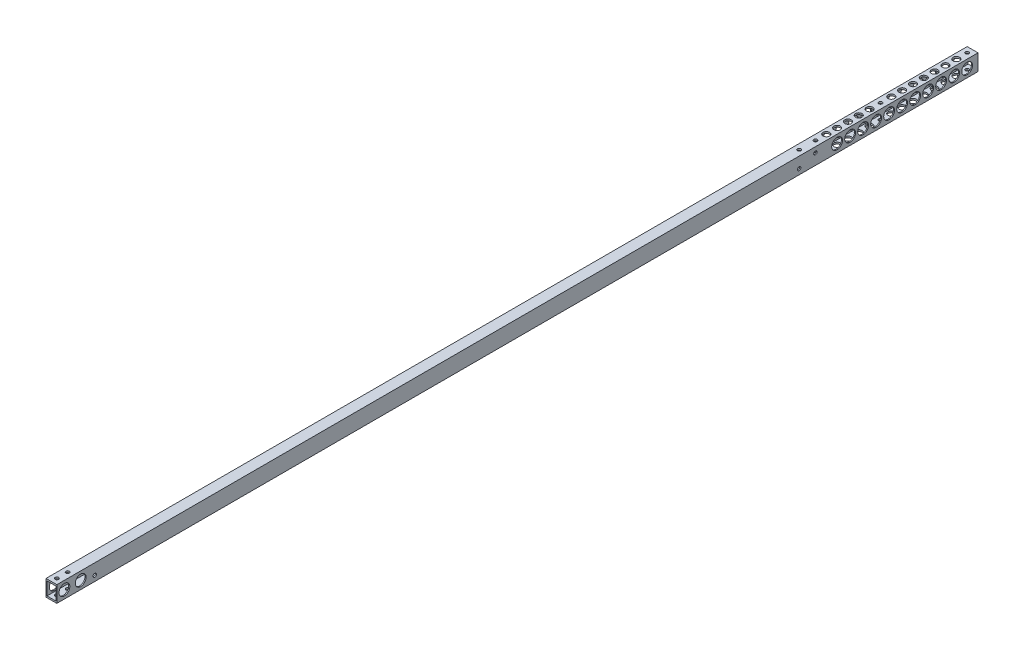
from build123d import *

# Parameters (mm, degrees)
SKETCH_1_W             = 10
SKETCH_1_H             = 15
SKETCH_1_W_2           = 8
SKETCH_1_H_2           = 12
EXTRUDE_1_DEPTH        = 850
SKETCH_2_R             = 1.6
CUT_EXTRUDE_1_DEPTH    = 851.091906796
SKETCH_3_R             = 5
CUT_EXTRUDE_2_DEPTH    = 851.091906796
SKETCH_4_R             = 1.6
CUT_EXTRUDE_3_DEPTH    = 851.147046104
SKETCH_7_R             = 1.6
CUT_EXTRUDE_6_DEPTH    = 851.147046104
SKETCH_8_R             = 5
CUT_EXTRUDE_7_DEPTH    = 851.091906796
PATTERN_LINEAR_1_COUNT = 11
PATTERN_LINEAR_1_PITCH = 12
SKETCH_9_R             = 1.6
CUT_EXTRUDE_8_DEPTH    = 851.147046104
PATTERN_LINEAR_2_COUNT = 2
PATTERN_LINEAR_2_PITCH = 15
SKETCH_10_R            = 3
CUT_EXTRUDE_9_DEPTH    = 851.147046104
PATTERN_LINEAR_3_COUNT = 7
PATTERN_LINEAR_3_PITCH = 10
SKETCH_11_R            = 3
CUT_EXTRUDE_10_DEPTH   = 851.147046104
PATTERN_LINEAR_4_COUNT = 5
PATTERN_LINEAR_4_PITCH = 10


with BuildPart() as part:
    # ｽｹｯﾁ1 → ﾎﾞｽ - 押し出し1 (new body)
    with BuildSketch(Plane.XY):
        Rectangle(SKETCH_1_W, SKETCH_1_H)
        Rectangle(SKETCH_1_W_2, SKETCH_1_H_2, mode=Mode.SUBTRACT)
    extrude(amount=EXTRUDE_1_DEPTH)

    # ｽｹｯﾁ2 → ｶｯﾄ - 押し出し1 (cut, through all)
    with BuildSketch(Plane.ZY.offset(5)):
        with Locations((165, -2.5)):
            Circle(SKETCH_2_R)
        with Locations((815, -2.5)):
            Circle(SKETCH_2_R)
        with Locations((150, 2.5)):
            Circle(SKETCH_2_R)
    extrude(amount=-CUT_EXTRUDE_1_DEPTH, mode=Mode.SUBTRACT)

    # ｽｹｯﾁ3 → ｶｯﾄ - 押し出し2 (cut, through all)
    with BuildSketch(Plane(origin=(5, 0, 0), x_dir=(0, 0, -1), z_dir=(1, 0, 0))):
        with Locations((-843, 0)):
            Circle(SKETCH_3_R)
    cut_extrude_2 = extrude(amount=-CUT_EXTRUDE_2_DEPTH, mode=Mode.SUBTRACT)

    # ｽｹｯﾁ4 → ｶｯﾄ - 押し出し3 (cut, through all)
    with BuildSketch(Plane(origin=(0, 7.5, 0), x_dir=(1, 0, 0), z_dir=(0, 1, 0))):
        with Locations(Location((0, -845, 0), (0, 0, 270))):
            Circle(SKETCH_4_R)
        with Locations(Location((0, -835, 0), (0, 0, 270))):
            Circle(SKETCH_4_R)
    extrude(amount=-CUT_EXTRUDE_3_DEPTH, mode=Mode.SUBTRACT)

    # ｽｹｯﾁ7 → ｶｯﾄ - 押し出し6 (cut, through all)
    with BuildSketch(Plane(origin=(0, -7.5, 0), x_dir=(-1, 0, 0), z_dir=(0, -1, 0))):
        with Locations(Location((0, -5, 0), (0, 0, 90))):
            Circle(SKETCH_7_R)
        with Locations(Location((0, -85, 0), (0, 0, 90))):
            Circle(SKETCH_7_R)
        with Locations(Location((0, -145, 0), (0, 0, 90))):
            Circle(SKETCH_7_R)
    extrude(amount=-CUT_EXTRUDE_6_DEPTH, mode=Mode.SUBTRACT)

    # ｽｹｯﾁ8 → ｶｯﾄ - 押し出し7 (cut, through all)
    with BuildSketch(Plane(origin=(5, 0, 0), x_dir=(0, 0, -1), z_dir=(1, 0, 0))):
        with Locations((-10, 0)):
            Circle(SKETCH_8_R)
    cut_extrude_7 = extrude(amount=-CUT_EXTRUDE_7_DEPTH, mode=Mode.SUBTRACT)

    # 直線ﾊﾟﾀｰﾝ1: ｶｯﾄ - 押し出し7 ×11
    with Locations(*[(0, 0, i * PATTERN_LINEAR_1_PITCH) for i in range(1, PATTERN_LINEAR_1_COUNT)]):
        add(cut_extrude_7, mode=Mode.SUBTRACT)

    # ｽｹｯﾁ9 → ｶｯﾄ - 押し出し8 (cut, through all)
    with BuildSketch(Plane(origin=(0, 7.5, 0), x_dir=(1, 0, 0), z_dir=(0, 1, 0))):
        with Locations(Location((0, -160, 0), (0, 0, 270))):
            Circle(SKETCH_9_R)
    extrude(amount=-CUT_EXTRUDE_8_DEPTH, mode=Mode.SUBTRACT)

    # 直線ﾊﾟﾀｰﾝ2: ｶｯﾄ - 押し出し2 ×2
    with Locations(*[(0, 0, -i * PATTERN_LINEAR_2_PITCH) for i in range(1, PATTERN_LINEAR_2_COUNT)]):
        add(cut_extrude_2, mode=Mode.SUBTRACT)

    # ｽｹｯﾁ10 → ｶｯﾄ - 押し出し9 (cut, through all)
    with BuildSketch(Plane(origin=(0, -7.5, 0), x_dir=(-1, 0, 0), z_dir=(0, -1, 0))):
        with Locations(Location((0, -15, 0), (0, 0, 90))):
            Circle(SKETCH_10_R)
    cut_extrude_9 = extrude(amount=-CUT_EXTRUDE_9_DEPTH, mode=Mode.SUBTRACT)

    # 直線ﾊﾟﾀｰﾝ3: ｶｯﾄ - 押し出し9 ×7
    with Locations(*[(0, 0, i * PATTERN_LINEAR_3_PITCH) for i in range(1, PATTERN_LINEAR_3_COUNT)]):
        add(cut_extrude_9, mode=Mode.SUBTRACT)

    # ｽｹｯﾁ11 → ｶｯﾄ - 押し出し10 (cut, through all)
    with BuildSketch(Plane(origin=(0, 7.5, 0), x_dir=(1, 0, 0), z_dir=(0, 1, 0))):
        with Locations(Location((0, -95, 0), (0, 0, 270))):
            Circle(SKETCH_11_R)
    cut_extrude_10 = extrude(amount=-CUT_EXTRUDE_10_DEPTH, mode=Mode.SUBTRACT)

    # 直線ﾊﾟﾀｰﾝ4: ｶｯﾄ - 押し出し10 ×5
    with Locations(*[(0, 0, i * PATTERN_LINEAR_4_PITCH) for i in range(1, PATTERN_LINEAR_4_COUNT)]):
        add(cut_extrude_10, mode=Mode.SUBTRACT)


solid = part.part
